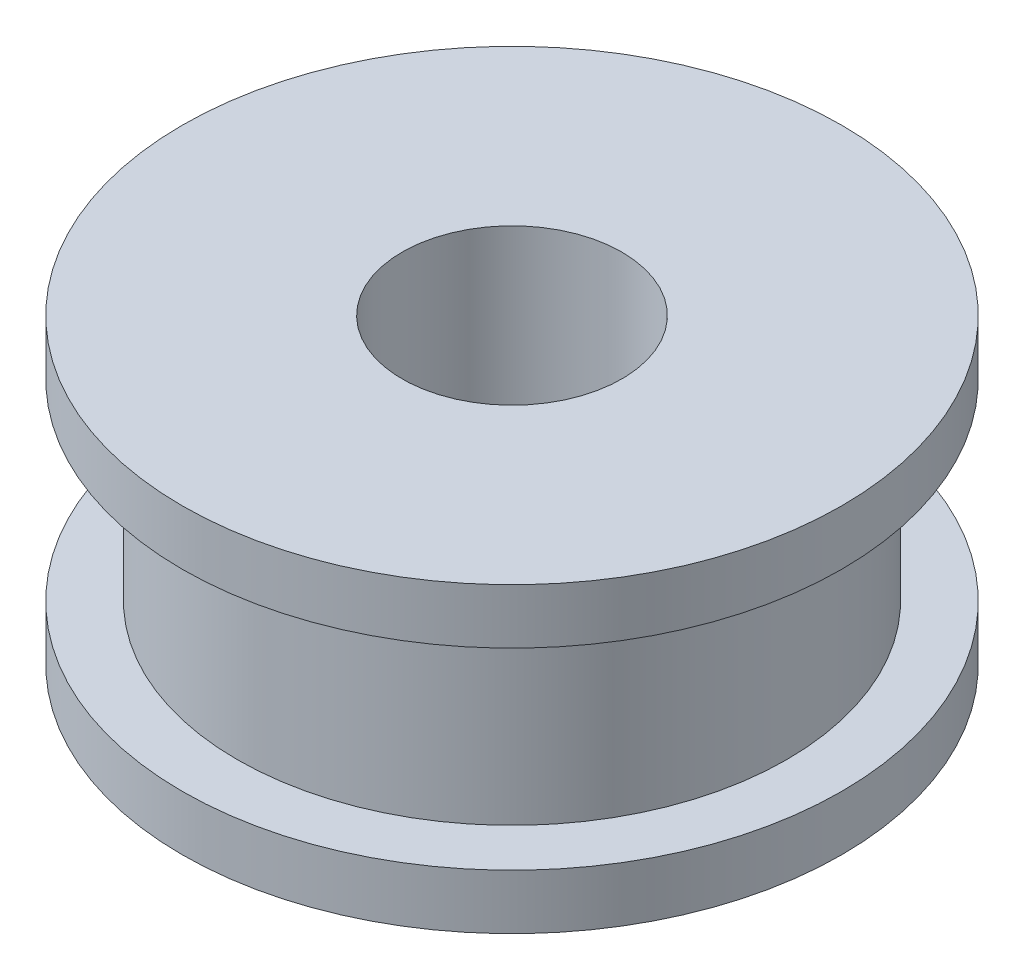
from build123d import *


with BuildPart() as part:
    # Sketch1 → Revolve1 (revolve)
    with BuildSketch(Plane.XY, mode=Mode.PRIVATE) as revolve1_sk:
        Polygon((4, 11), (4, 0), (12, 0), (12, 2), (10, 2), (10, 9), (12, 9), (12, 11), align=None)
    revolve(revolve1_sk.sketch.rotate(Axis((0, 0, 0), (0, 1, 0)), 90), axis=Axis((0, 0, 0), (0, 1, 0)))


solid = part.part
